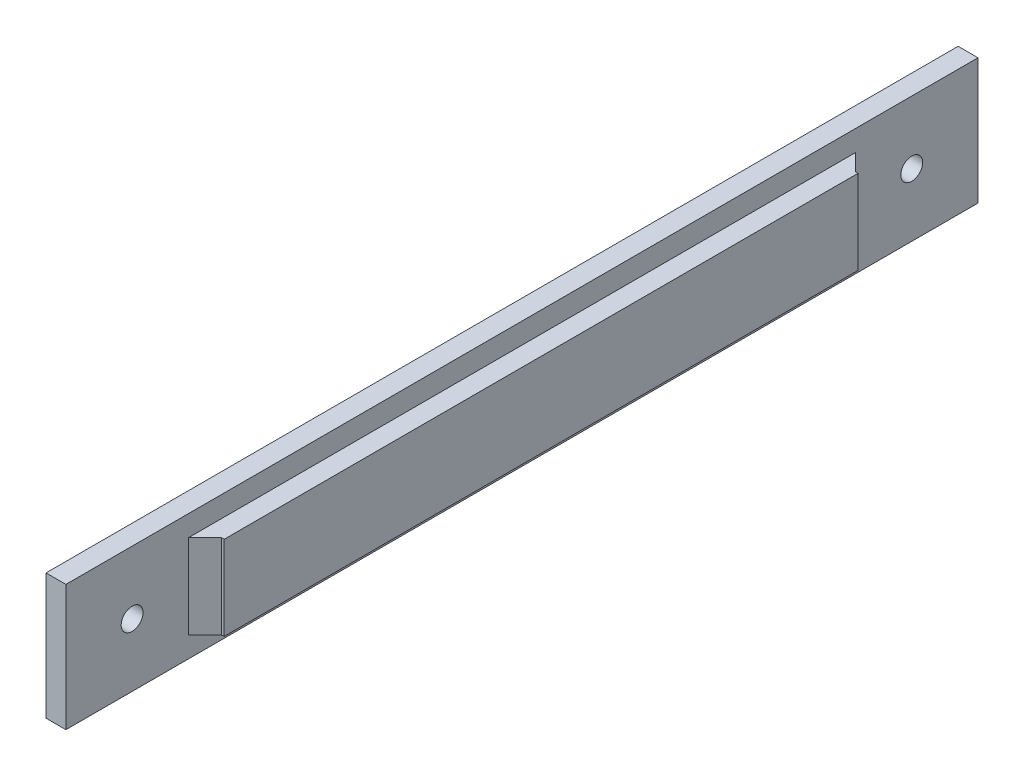
from build123d import *

# Parameters (mm, degrees)
SKETCH_1_W          = 19
SKETCH_1_H          = 19
SKETCH_1_W_2        = 13
SKETCH_1_H_2        = 13
EXTRUDE_1_DEPTH     = 137.7
SKETCH_2_R          = 1.65
CUT_EXTRUDE_1_DEPTH = 30
SKETCH_3_W          = 137.7
SKETCH_3_H          = 19
CUT_EXTRUDE_2_DEPTH = 16
SKETCH_4_W          = 95.7
SKETCH_4_H          = 12.7
EXTRUDE_1_2_DEPTH   = 2.9
CHAMFER_1_SIZE      = 2.5


with BuildPart() as part:
    # 草图1 → Extrude 1 (new body)
    with BuildSketch(Plane.XY):
        with Locations((6.5, 6.5)):
            Rectangle(SKETCH_1_W, SKETCH_1_H)
        with Locations((6.5, 6.5)):
            Rectangle(SKETCH_1_W_2, SKETCH_1_H_2, mode=Mode.SUBTRACT)
    extrude(amount=EXTRUDE_1_DEPTH)

    # 草图2 → 切除-拉伸1 (cut)
    with BuildSketch(Plane.ZY.offset(3)):
        with Locations((10, 6.5)):
            Circle(SKETCH_2_R)
        with Locations((127.7, 6.5)):
            Circle(SKETCH_2_R)
    extrude(amount=-CUT_EXTRUDE_1_DEPTH, mode=Mode.SUBTRACT)

    # 草图3 → 切除-拉伸2 (cut)
    with BuildSketch(Plane(origin=(16, 0, 0), x_dir=(0, 0, -1), z_dir=(1, 0, 0))):
        with Locations((-68.85, 6.5)):
            Rectangle(SKETCH_3_W, SKETCH_3_H)
    extrude(amount=-CUT_EXTRUDE_2_DEPTH, mode=Mode.SUBTRACT)

    # 草图4 → Extrude 1 2 (add)
    with BuildSketch(Plane(origin=(0, 0, 0), x_dir=(0, 0, -1), z_dir=(1, 0, 0))):
        with Locations((-68.85, 6.5)):
            Rectangle(SKETCH_4_W, SKETCH_4_H)
    extrude(amount=EXTRUDE_1_2_DEPTH)

    # 倒角1
    chamfer_1_edges = [part.edges().sort_by_distance(p)[0] for p in [
        (0, 6.5, 116.7),
        (0, 6.5, 21),
    ]]
    chamfer(chamfer_1_edges, length=CHAMFER_1_SIZE)


solid = part.part
